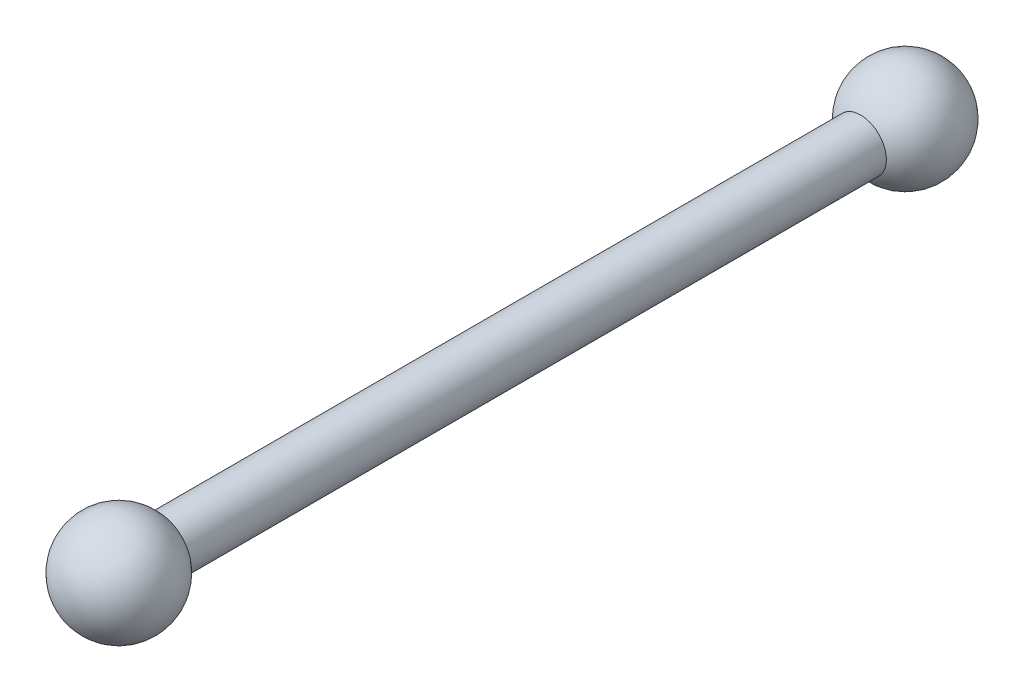
from build123d import *

# Parameters (mm, degrees)
SKETCH1_R           = 2
BOSS_EXTRUDE1_DEPTH = 55


with BuildPart() as part:
    # Sketch1 → Boss-Extrude1 (new body)
    with BuildSketch(Plane.XY):
        Circle(SKETCH1_R)
    extrude(amount=-BOSS_EXTRUDE1_DEPTH)

    # Sketch2 → Revolve1 (revolve)
    with BuildSketch(Plane.XY.offset(3)):
        with BuildLine():
            Line((0, 4), (0, -4))
            ThreePointArc((0, -4), (4, 0), (0, 4))
        make_face()
    revolve1 = revolve(axis=Axis((0, 4, 3), (0, -1, 0)))

    # Mirror2: Revolve1 across plane
    add(revolve1.mirror(Plane.XY.offset(-27.5)))


solid = part.part
